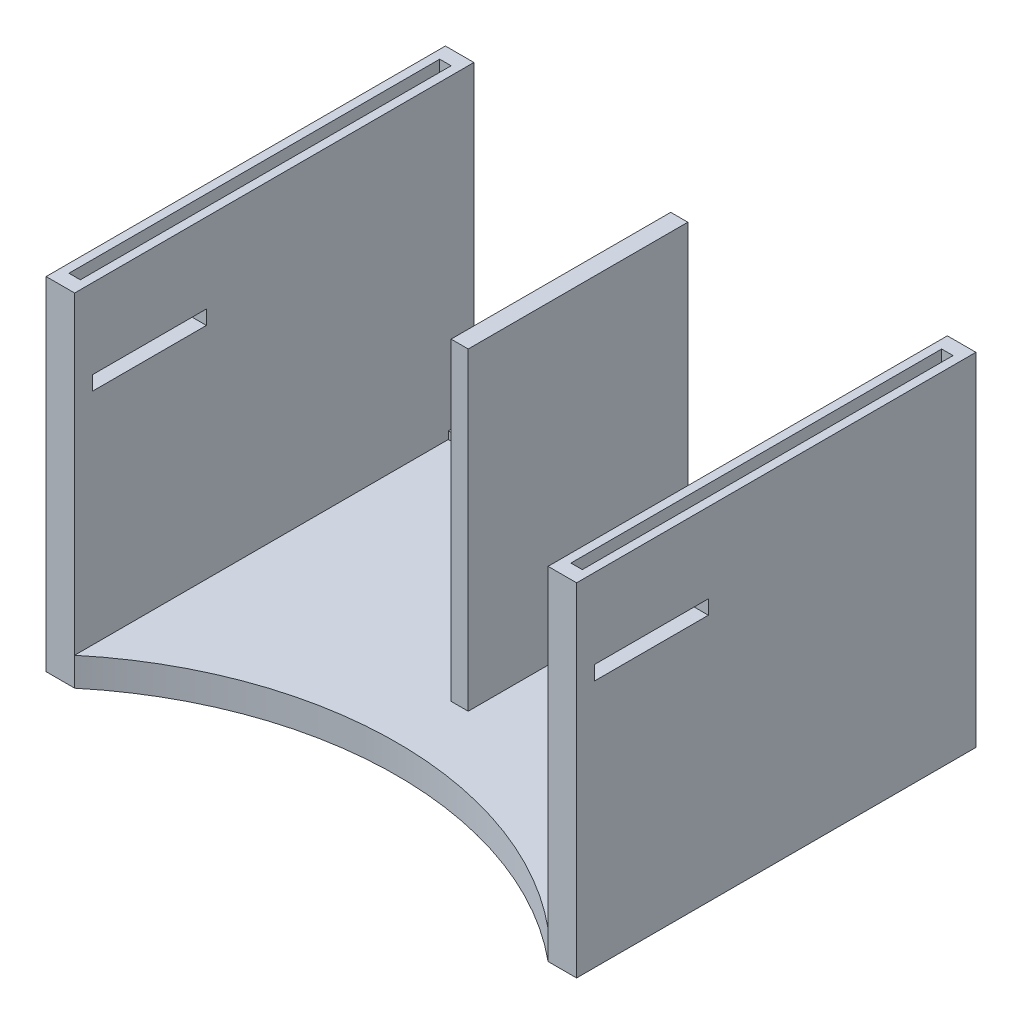
from build123d import *

# Parameters (mm, degrees)
EXTRUDE_THIN2_DEPTH     = 140
SKETCH11_W              = 166
SKETCH11_H              = 5
BOSS_EXTRUDE3_DEPTH     = 2.6416
CUT_EXTRUDE6_DEPTH      = 255.903903462
CUT_EXTRUDE6_DEPTH_BACK = 255.903903462
SKETCH13_W              = 40
SKETCH13_H              = 5
CUT_EXTRUDE7_DEPTH      = 258.480096318
SKETCH19_W              = 4
SKETCH19_H              = 130
CUT_EXTRUDE9_DEPTH      = 10
SKETCH20_W              = 4
SKETCH20_H              = 130
CUT_EXTRUDE10_DEPTH     = 10
SKETCH21_W              = 6
SKETCH21_H              = 77
BOSS_EXTRUDE4_DEPTH     = 110


with BuildPart() as part:
    # Sketch2 → Extrude-Thin2 (new body)
    with BuildSketch(Plane.XY):
        Polygon((0, 120), (0, 0), (186, 0), (186, 120), (176, 120), (176, 10), (10, 10), (10, 120), align=None)
    extrude(amount=EXTRUDE_THIN2_DEPTH)

    # Sketch11 → Boss-Extrude3 (add)
    with BuildSketch(Plane(origin=(0, 10, 0), x_dir=(1, 0, 0), z_dir=(0, 1, 0))):
        with Locations((93, -6.5)):
            Rectangle(SKETCH11_W, SKETCH11_H)
    extrude(amount=BOSS_EXTRUDE3_DEPTH)

    # Sketch13 → Cut-Extrude6 (cut, two sides: drawn at the far end of the back side and taken through both)
    with BuildSketch(Plane(origin=(10, 0, 0), x_dir=(0, 0, -1), z_dir=(1, 0, 0)).offset(-CUT_EXTRUDE6_DEPTH_BACK)):
        with Locations((-113.795011338, 89.551599899)):
            Rectangle(SKETCH13_W, SKETCH13_H)
    extrude(amount=CUT_EXTRUDE6_DEPTH + CUT_EXTRUDE6_DEPTH_BACK, mode=Mode.SUBTRACT)

    # Sketch14 → Cut-Extrude7 (cut, through all)
    with BuildSketch(Plane(origin=(0, 10, 0), x_dir=(1, 0, 0), z_dir=(0, 1, 0))):
        with BuildLine():
            Line((176, -140), (10, -140))
            ThreePointArc((10, -140), (93, -110), (176, -140))
        make_face()
    extrude(amount=-CUT_EXTRUDE7_DEPTH, mode=Mode.SUBTRACT)

    # Sketch19 → Cut-Extrude9 (cut)
    with BuildSketch(Plane(origin=(0, 120, 0), x_dir=(1, 0, 0), z_dir=(0, 1, 0))):
        with Locations((5, -70)):
            Rectangle(SKETCH19_W, SKETCH19_H)
    extrude(amount=-CUT_EXTRUDE9_DEPTH, mode=Mode.SUBTRACT)

    # Sketch20 → Cut-Extrude10 (cut)
    with BuildSketch(Plane(origin=(0, 120, 0), x_dir=(1, 0, 0), z_dir=(0, 1, 0))):
        with Locations((181, -70)):
            Rectangle(SKETCH20_W, SKETCH20_H)
    extrude(amount=-CUT_EXTRUDE10_DEPTH, mode=Mode.SUBTRACT)

    # Sketch21 → Boss-Extrude4 (add, through all)
    with BuildSketch(Plane(origin=(0, 10, 0), x_dir=(1, 0, 0), z_dir=(0, 1, 0))):
        with Locations((93, -49.5)):
            Rectangle(SKETCH21_W, SKETCH21_H)
    extrude(amount=BOSS_EXTRUDE4_DEPTH)


solid = part.part
